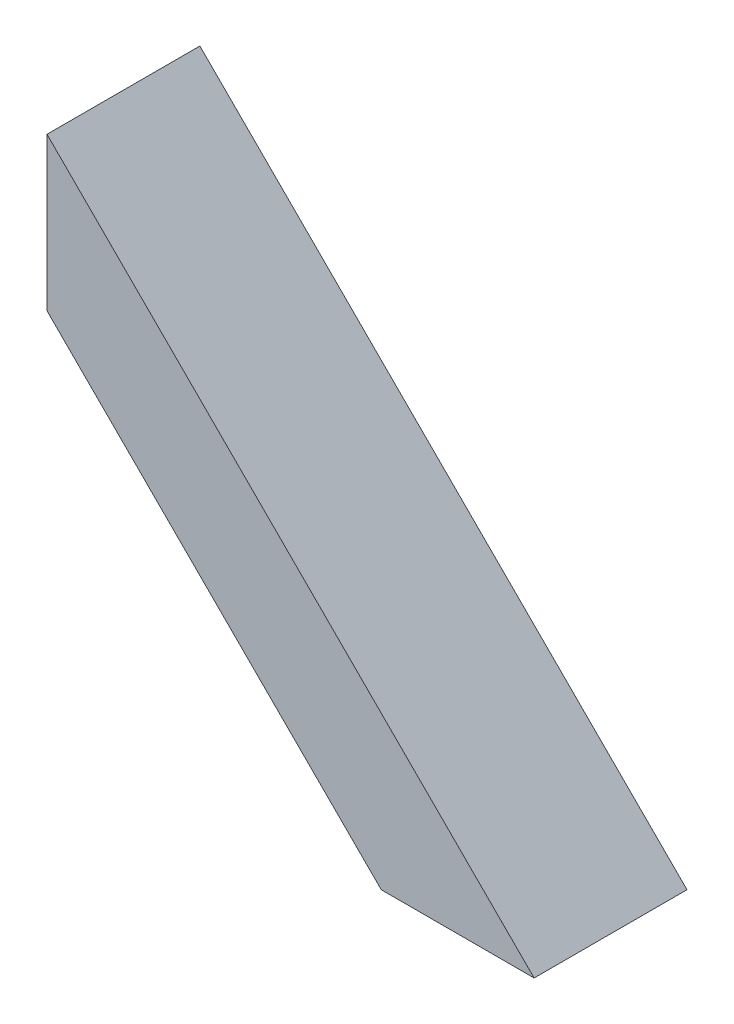
from build123d import *

# Parameters (mm, degrees)
BOSS_EXTRUDE1_DEPTH = 5


with BuildPart() as part:
    # Sketch1 → Boss-Extrude1 (new body)
    with BuildSketch(Plane.XY):
        Polygon((-7.191114458, 5.048070381), (-7.191114458, 0.048070381), (3.74114267, -10.884186747), (8.74114267, -10.884186747), align=None)
    extrude(amount=BOSS_EXTRUDE1_DEPTH)


solid = part.part
